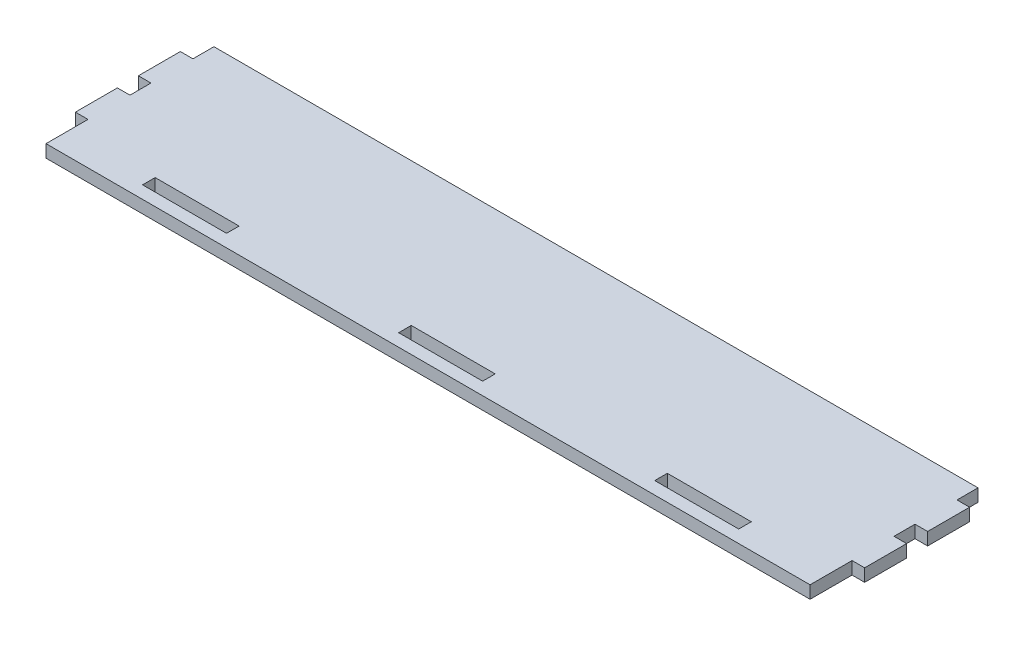
from build123d import *

# Parameters (mm, degrees)
SKETCH1_W           = 20
SKETCH1_H           = 3
BOSS_EXTRUDE1_DEPTH = 3


with BuildPart() as part:
    # Sketch1 → Boss-Extrude1 (new body)
    with BuildSketch(Plane(origin=(0, 0, 0), x_dir=(1, 0, 0), z_dir=(0, 1, 0))):
        Polygon((0, 35), (0, 40), (182, 40), (182, 35), (185, 35), (185, 25), (182, 25), (182, 20), (185, 20), (185, 10), (182, 10), (182, 0), (0, 0), (0, 10), (-3, 10), (-3, 20), (0, 20), (0, 25), (-3, 25), (-3, 35), align=None)
        with Locations((30, 4.5)):
            Rectangle(SKETCH1_W, SKETCH1_H, mode=Mode.SUBTRACT)
        with Locations((152, 4.5)):
            Rectangle(SKETCH1_W, SKETCH1_H, mode=Mode.SUBTRACT)
        with Locations((91, 4.5)):
            Rectangle(SKETCH1_W, SKETCH1_H, mode=Mode.SUBTRACT)
    extrude(amount=BOSS_EXTRUDE1_DEPTH)


solid = part.part
